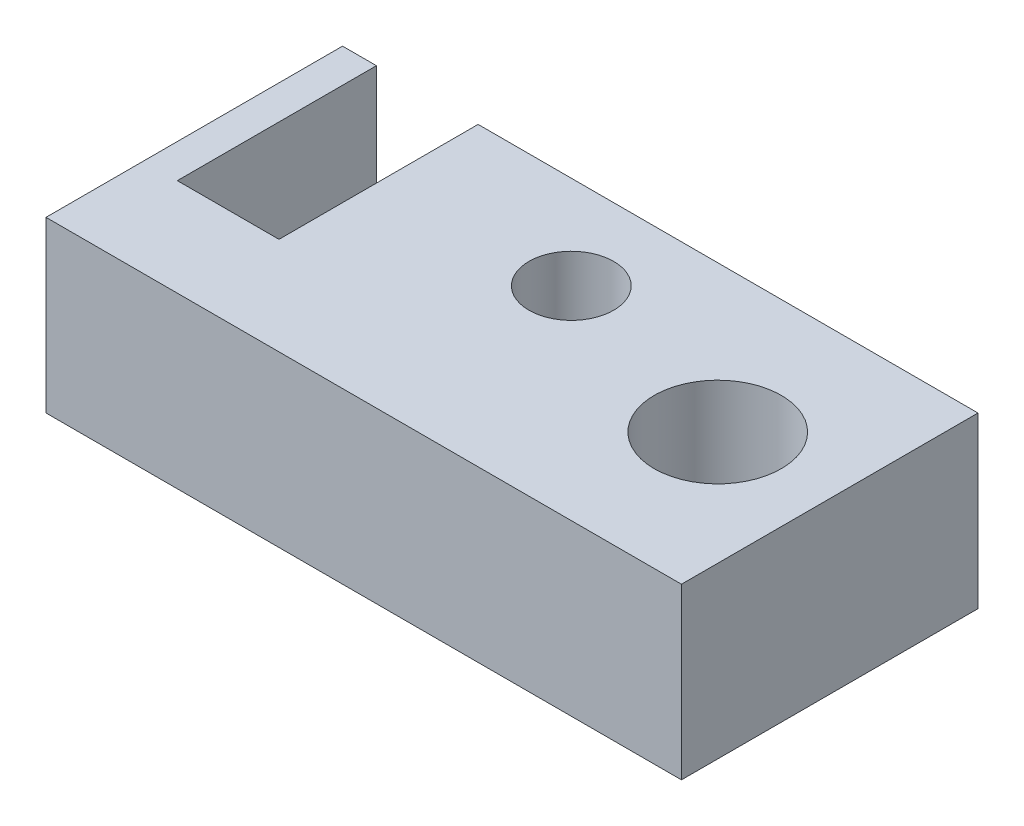
from build123d import *

# Parameters (mm, degrees)
SKETCH1_W           = 75
SKETCH1_H           = 35
SKETCH1_R           = 7.5
SKETCH1_R_2         = 4
BOSS_EXTRUDE1_DEPTH = 20
SKETCH2_W           = 12
SKETCH2_H           = 23.5
CUT_EXTRUDE1_DEPTH  = 15
SKETCH3_R           = 5
CUT_EXTRUDE2_DEPTH  = 46.961940777


with BuildPart() as part:
    # Sketch1 → Boss-Extrude1 (new body)
    with BuildSketch(Plane(origin=(0, 0, 0), x_dir=(1, 0, 0), z_dir=(0, 1, 0))):
        Rectangle(SKETCH1_W, SKETCH1_H)
        with Locations(Location((24.087416082, 0.196874766, 0), (0, 0, 270))):
            Circle(SKETCH1_R, mode=Mode.SUBTRACT)
        with Locations(Location((-27.5, 0.196874766, 0), (0, 0, 270))):
            Circle(SKETCH1_R_2, mode=Mode.SUBTRACT)
    extrude(amount=BOSS_EXTRUDE1_DEPTH)

    # Sketch2 → Cut-Extrude1 (cut)
    with BuildSketch(Plane(origin=(0, 20, 0), x_dir=(1, 0, 0), z_dir=(0, 1, 0))):
        with Locations((-27.5, 5.75)):
            Rectangle(SKETCH2_W, SKETCH2_H)
    extrude(amount=-CUT_EXTRUDE1_DEPTH, mode=Mode.SUBTRACT)

    # Sketch3 → Cut-Extrude2 (cut, through all)
    with BuildSketch(Plane(origin=(0, 20, 0), x_dir=(1, 0, 0), z_dir=(0, 1, 0))):
        with Locations(Location((0.5, 6.5, 0), (0, 0, 270))):
            Circle(SKETCH3_R)
    extrude(amount=-CUT_EXTRUDE2_DEPTH, mode=Mode.SUBTRACT)


solid = part.part
